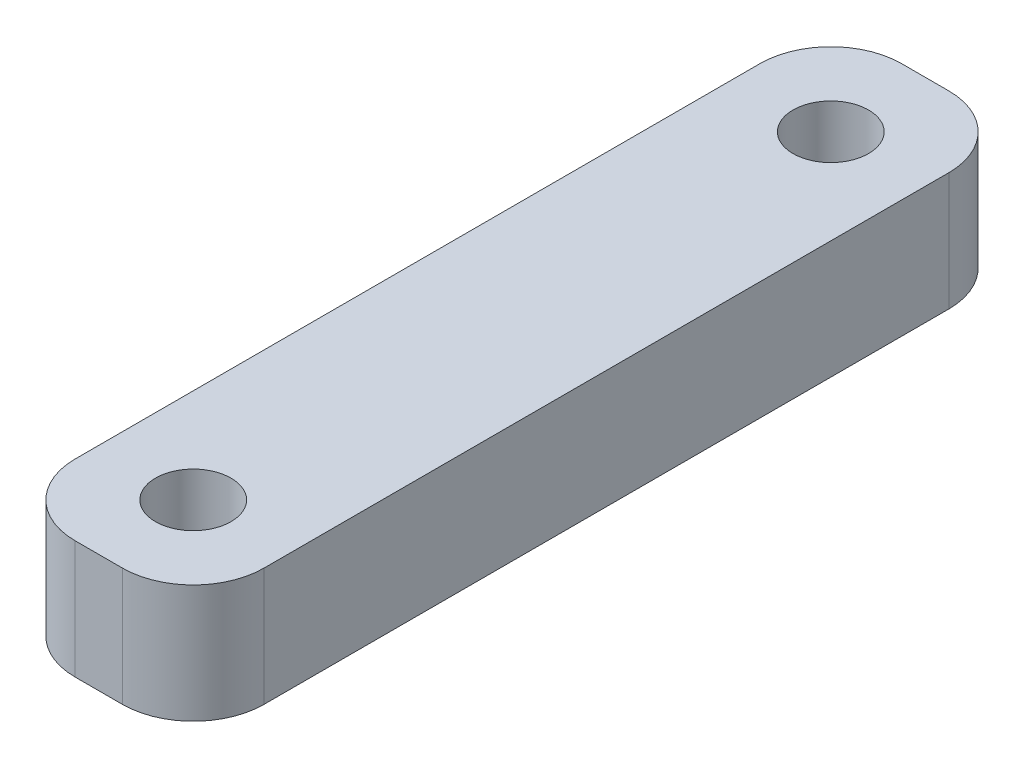
from build123d import *

# Parameters (mm, degrees)
SKETCH1_W           = 8
SKETCH1_H           = 5
BOSS_EXTRUDE1_DEPTH = 35
SKETCH2_R           = 1.6
CUT_EXTRUDE1_DEPTH  = 37.249137921
FILLET1_R           = 3


with BuildPart() as part:
    # Sketch1 → Boss-Extrude1 (new body)
    with BuildSketch(Plane.XY):
        with Locations((4, -2.5)):
            Rectangle(SKETCH1_W, SKETCH1_H)
    extrude(amount=BOSS_EXTRUDE1_DEPTH)

    # Sketch2 → Cut-Extrude1 (cut, through all)
    with BuildSketch(Plane(origin=(0, 0, 0), x_dir=(1, 0, 0), z_dir=(0, 1, 0))):
        with Locations(Location((4, -4, 0), (0, 0, 270))):
            Circle(SKETCH2_R)
        with Locations(Location((4, -31, 0), (0, 0, 270))):
            Circle(SKETCH2_R)
    extrude(amount=-CUT_EXTRUDE1_DEPTH, mode=Mode.SUBTRACT)

    # Fillet1
    fillet1_edges = [part.edges().sort_by_distance(p)[0] for p in [
        (8, -2.5, 35),
        (0, -2.5, 35),
        (8, -2.5, 0),
        (0, -2.5, 0),
    ]]
    fillet(fillet1_edges, radius=FILLET1_R)


solid = part.part
